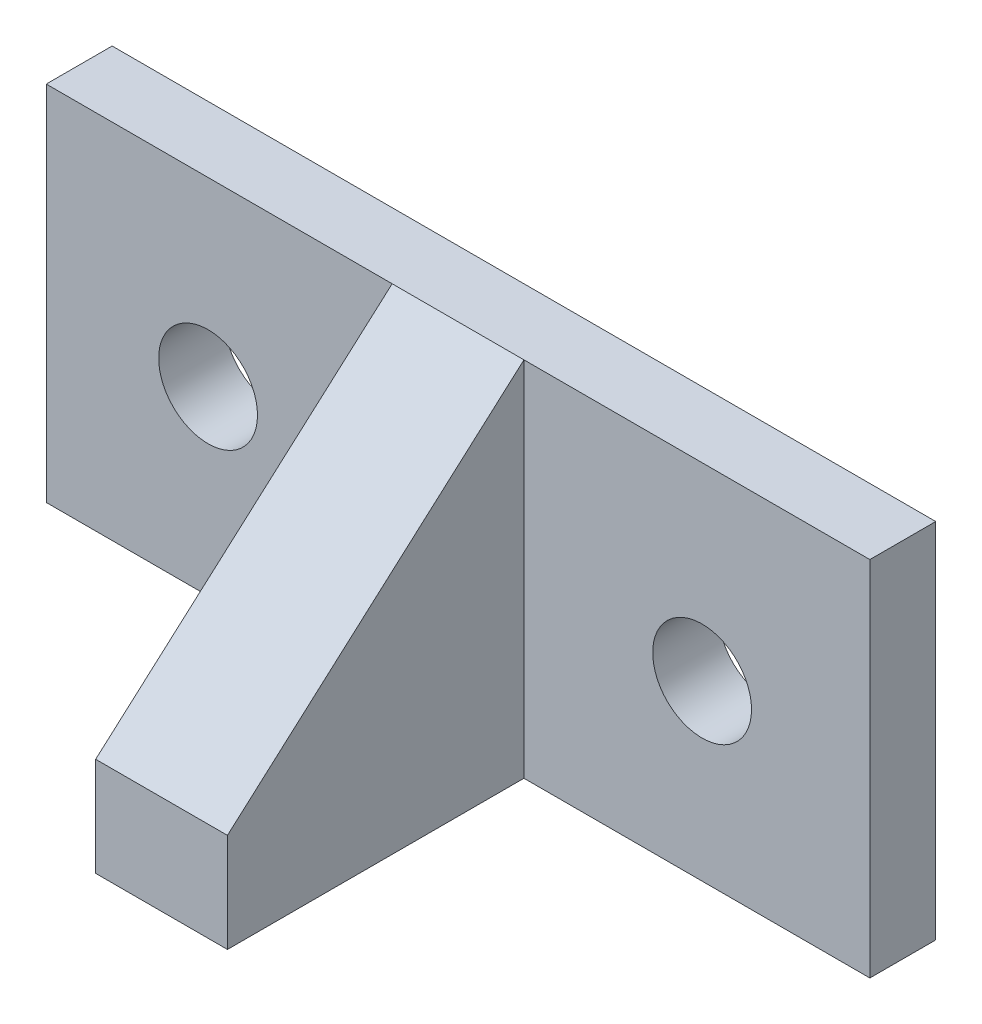
from build123d import *

# Parameters (mm, degrees)
BOSS_EXTRUDE1_DEPTH = 125
CUT_EXTRUDE1_DEPTH  = 52.5
CUT_EXTRUDE2_START  = -125
CUT_EXTRUDE2_DEPTH  = 52.5
SKETCH3_R           = 7.5
CUT_EXTRUDE3_DEPTH  = 10


with BuildPart() as part:
    # Sketch1 → Boss-Extrude1 (new body)
    with BuildSketch(Plane(origin=(0, 0, 0), x_dir=(0, 0, -1), z_dir=(1, 0, 0))):
        Polygon((-10, -27.5), (-10, 27.5), (-55, -12.5), (-55, -27.5), align=None)
        Polygon((0, -27.5), (0, 0), (0, 27.5), (-10, 27.5), (-10, -27.5), align=None)
    extrude(amount=-BOSS_EXTRUDE1_DEPTH)

    # Sketch1<3> → Cut-Extrude1 (cut)
    with BuildSketch(Plane(origin=(0, 0, 0), x_dir=(0, 0, -1), z_dir=(1, 0, 0))):
        Polygon((-10, -27.5), (-10, 27.5), (-55, -12.5), (-55, -27.5), align=None)
    extrude(amount=-CUT_EXTRUDE1_DEPTH, mode=Mode.SUBTRACT)

    # Sketch1<4> → Cut-Extrude2 (cut)
    with BuildSketch(Plane(origin=(0, 0, 0), x_dir=(0, 0, -1), z_dir=(1, 0, 0)).offset(CUT_EXTRUDE2_START)):
        Polygon((-10, -27.5), (-10, 27.5), (-55, -12.5), (-55, -27.5), align=None)
    extrude(amount=CUT_EXTRUDE2_DEPTH, mode=Mode.SUBTRACT)

    # Sketch3 → Cut-Extrude3 (cut)
    with BuildSketch(Plane.XY.offset(10)):
        with BuildLine():
            Line((-107.939200619, 0), (-100.439200619, 0))
            Line((-100.439200619, 0), (-92.939200619, 0))
            ThreePointArc((-92.939200619, 0), (-100.439200619, 7.5), (-107.939200619, 0))
        make_face()
        with BuildLine():
            Line((-92.939200619, 0), (-100.439200619, 0))
            Line((-100.439200619, 0), (-107.939200619, 0))
            ThreePointArc((-107.939200619, 0), (-100.439200619, -7.5), (-92.939200619, 0))
        make_face()
        with Locations((-25.458326039, -1.197514418)):
            Circle(SKETCH3_R)
    extrude(amount=-CUT_EXTRUDE3_DEPTH, mode=Mode.SUBTRACT)


solid = part.part
